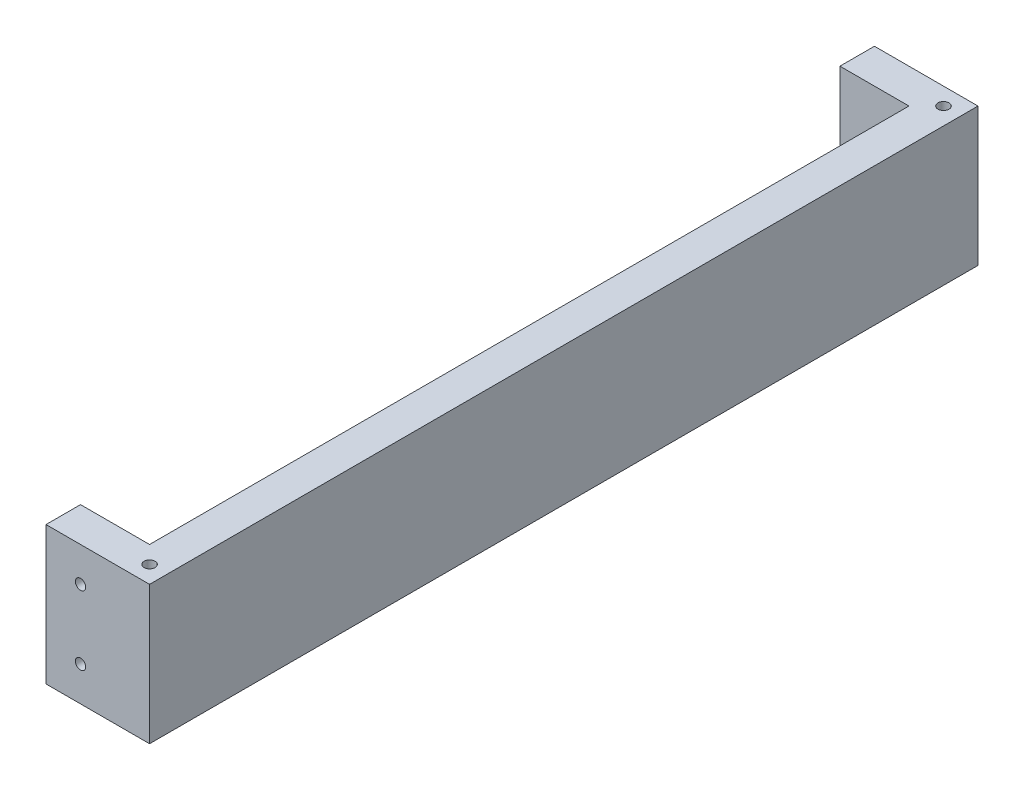
from build123d import *

# Parameters (mm, degrees)
SKETCH_1_W          = 2
SKETCH_1_H          = 120
EXTRUDE_1_DEPTH     = 2
SKETCH_3_W          = 120
SKETCH_3_H          = 20
EXTRUDE_3_DEPTH     = 15
SKETCH_4_W          = 10
SKETCH_4_H          = 11
CUT_EXTRUDE_1_DEPTH = 123.702893201
SKETCH_5_W          = 2
SKETCH_5_H          = 17
CUT_EXTRUDE_2_DEPTH = 66.238025721
SKETCH_6_W          = 15
SKETCH_6_H          = 5
EXTRUDE_4_DEPTH     = 11
SKETCH_7_R          = 0.75
CUT_EXTRUDE_3_DEPTH = 2
CUT_EXTRUDE_START   = -118
SKETCH_7_3_R        = 0.75
CUT_EXTRUDE_4_DEPTH = 2
SKETCH_8_R          = 0.8
CUT_EXTRUDE_5_DEPTH = 2


with BuildPart() as part:
    # 草图1 → 凸台-拉伸1 (new body)
    with BuildSketch(Plane(origin=(0, 0, 0), x_dir=(1, 0, 0), z_dir=(0, 1, 0))):
        Rectangle(SKETCH_1_W, SKETCH_1_H)
    extrude(amount=EXTRUDE_1_DEPTH)

    # 草图3 → 凸台-拉伸3 (add)
    with BuildSketch(Plane(origin=(1, 0, 0), x_dir=(0, 0, -1), z_dir=(1, 0, 0))):
        with Locations((0, 10)):
            Rectangle(SKETCH_3_W, SKETCH_3_H)
    extrude(amount=EXTRUDE_3_DEPTH)

    # 草图4 → 切除-拉伸1 (cut, through all)
    with BuildSketch(Plane.XY.offset(60)):
        with Locations((6, 14.5)):
            Rectangle(SKETCH_4_W, SKETCH_4_H)
    extrude(amount=-CUT_EXTRUDE_1_DEPTH, mode=Mode.SUBTRACT)

    # 草图5 → 切除-拉伸2 (cut, through all)
    with BuildSketch(Plane.XZ):
        with Locations((0, 51.5)):
            Rectangle(SKETCH_5_W, SKETCH_5_H)
        with Locations((0, -51.5)):
            Rectangle(SKETCH_5_W, SKETCH_5_H)
    extrude(amount=-CUT_EXTRUDE_2_DEPTH, mode=Mode.SUBTRACT)

    # 草图6 → 凸台-拉伸4 (add)
    with BuildSketch(Plane(origin=(0, 9, 0), x_dir=(1, 0, 0), z_dir=(0, 1, 0))):
        with Locations((8.5, -57.5)):
            Rectangle(SKETCH_6_W, SKETCH_6_H)
        with Locations((8.5, 57.5)):
            Rectangle(SKETCH_6_W, SKETCH_6_H)
    extrude(amount=EXTRUDE_4_DEPTH)

    # 草图7 → 切除-拉伸3 (cut)
    with BuildSketch(Plane(origin=(0, 0, -60), x_dir=(-1, 0, 0), z_dir=(0, 0, -1))):
        with Locations((-6, 15)):
            Circle(SKETCH_7_R)
        with Locations((-6, 5)):
            Circle(SKETCH_7_R)
    extrude(amount=-CUT_EXTRUDE_3_DEPTH, mode=Mode.SUBTRACT)

    # 草图7<3> → 切除-拉伸4 (cut)
    with BuildSketch(Plane(origin=(0, 0, -60), x_dir=(-1, 0, 0), z_dir=(0, 0, -1)).offset(CUT_EXTRUDE_START)):
        with Locations((-6, 15)):
            Circle(SKETCH_7_3_R)
        with Locations((-6, 5)):
            Circle(SKETCH_7_3_R)
    extrude(amount=-CUT_EXTRUDE_4_DEPTH, mode=Mode.SUBTRACT)

    # 草图8 → 切除-拉伸5 (cut)
    with BuildSketch(Plane(origin=(0, 20, 0), x_dir=(1, 0, 0), z_dir=(0, 1, 0))):
        with Locations(Location((13.5, -57.5, 0), (0, 0, 270))):
            Circle(SKETCH_8_R)
        with Locations(Location((13.5, 57.5, 0), (0, 0, 270))):
            Circle(SKETCH_8_R)
    extrude(amount=-CUT_EXTRUDE_5_DEPTH, mode=Mode.SUBTRACT)


solid = part.part
